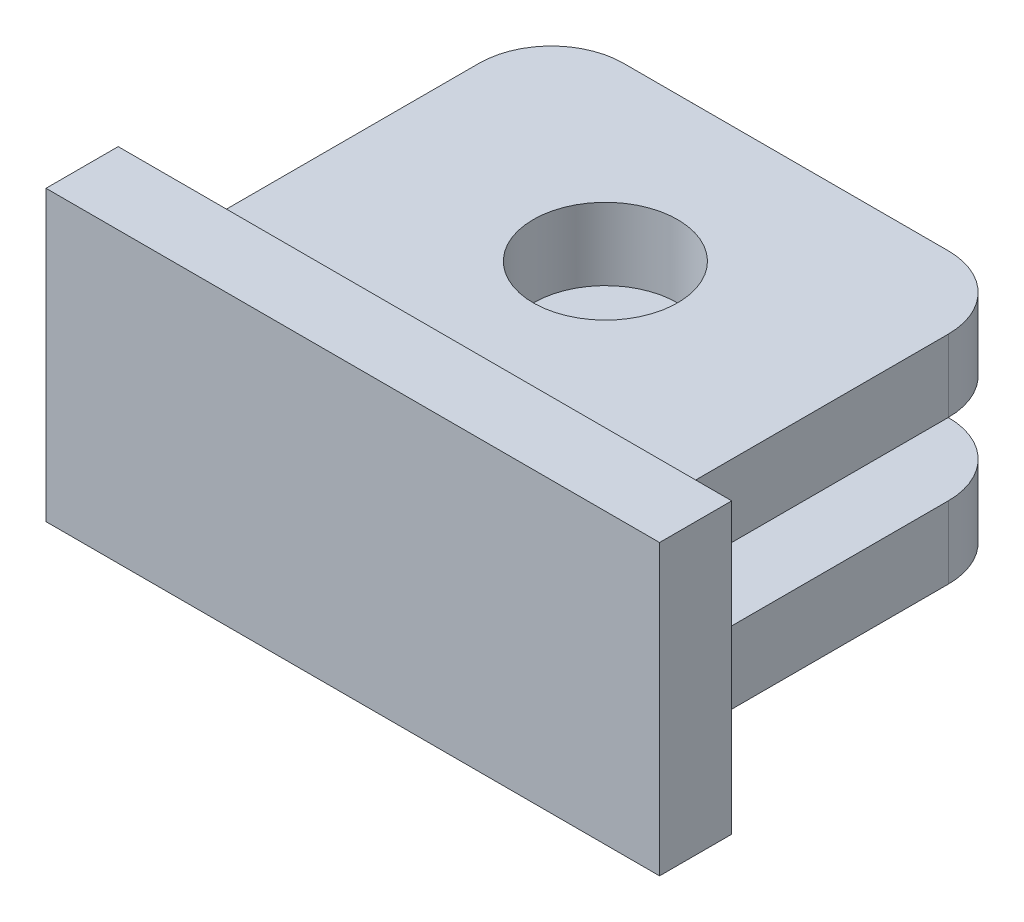
from build123d import *

# Parameters (mm, degrees)
IZIM1_W                     = 170
IZIM1_H                     = 200
Y_KSEKLIK_EKSTR_ZYON1_DEPTH = 20
IZIM2_W                     = 130
IZIM2_H                     = 20
Y_KSEKLIK_EKSTR_ZYON2_DEPTH = 100
RADYUS1_R                   = 20
IZIM3_R                     = 20
KES_EKSTR_ZYON1_DEPTH       = 100
IZIM4_R                     = 20
Y_KSEKLIK_EKSTR_ZYON3_DEPTH = 20
IZIM5_W                     = 170
IZIM5_H                     = 40
IZIM5_H_2                   = 80
KES_EKSTR_ZYON2_DEPTH       = 79


with BuildPart() as part:
    # Çizim1 → Yükseklik-Ekstrüzyon1 (new body)
    with BuildSketch(Plane.XY):
        with Locations((85, 100)):
            Rectangle(IZIM1_W, IZIM1_H)
    extrude(amount=Y_KSEKLIK_EKSTR_ZYON1_DEPTH)

    # Çizim2 → Yükseklik-Ekstrüzyon2 (add)
    with BuildSketch(Plane(origin=(0, 0, 0), x_dir=(-1, 0, 0), z_dir=(0, 0, -1))):
        with Locations((-85, 140)):
            Rectangle(IZIM2_W, IZIM2_H)
    extrude(amount=Y_KSEKLIK_EKSTR_ZYON2_DEPTH)

    # Radyus1
    radyus1_edges = [part.edges().sort_by_distance(p)[0] for p in [
        (150, 140, -100),
        (20, 140, -100),
    ]]
    fillet(radyus1_edges, radius=RADYUS1_R)

    # Çizim3 → Kes-Ekstrüzyon1 (cut)
    with BuildSketch(Plane(origin=(0, 150, 0), x_dir=(1, 0, 0), z_dir=(0, 1, 0))):
        with Locations(Location((85, 50, 0), (0, 0, 180))):
            Circle(IZIM3_R)
    extrude(amount=-KES_EKSTR_ZYON1_DEPTH, mode=Mode.SUBTRACT)

    # Çizim4 → Yükseklik-Ekstrüzyon3 (add)
    with BuildSketch(Plane(origin=(0, 110, 0), x_dir=(-1, 0, 0), z_dir=(0, -1, 0))):
        with BuildLine():
            Line((-20, 0), (-20, 80))
            ThreePointArc((-20, 80), (-25.857864376, 94.142135624), (-40, 100))
            Line((-40, 100), (-130, 100))
            ThreePointArc((-130, 100), (-144.142135624, 94.142135624), (-150, 80))
            Line((-150, 80), (-150, 0))
            Line((-150, 0), (-20, 0))
        make_face()
        with Locations((-85, 50)):
            Circle(IZIM4_R, mode=Mode.SUBTRACT)
    extrude(amount=Y_KSEKLIK_EKSTR_ZYON3_DEPTH)

    # Çizim5 → Kes-Ekstrüzyon2 (cut)
    with BuildSketch(Plane(origin=(0, 0, 0), x_dir=(-1, 0, 0), z_dir=(0, 0, -1))):
        with Locations((-85, 180)):
            Rectangle(IZIM5_W, IZIM5_H)
        with Locations((-85, 40)):
            Rectangle(IZIM5_W, IZIM5_H_2)
    extrude(amount=-KES_EKSTR_ZYON2_DEPTH, mode=Mode.SUBTRACT)


solid = part.part
